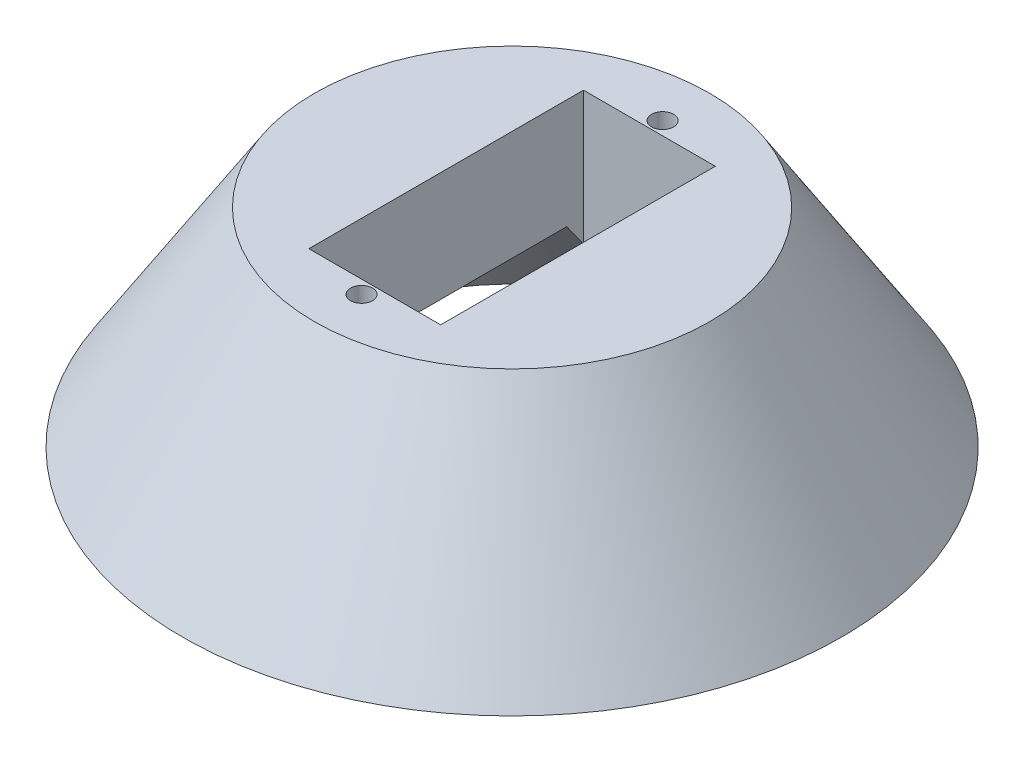
from build123d import *

# Parameters (mm, degrees)
SHELL2_T           = -10
SKETCH6_W          = 12
SKETCH6_H          = 25
CUT_EXTRUDE2_DEPTH = 47.434654221
SKETCH7_R          = 1
CUT_EXTRUDE3_DEPTH = 5


with BuildPart() as part:
    # Sketch5 → Revolve3 (revolve)
    with BuildSketch(Plane.XY, mode=Mode.PRIVATE) as revolve3_sk:
        Polygon((0, 0), (0, 18.872655155), (-18, 18.872655155), (-30, 0), align=None)
    revolve(revolve3_sk.sketch.rotate(Axis((0, 0, 0), (0, 1, 0)), 270), axis=Axis((0, 0, 0), (0, 1, 0)))

    # Shell2
    shell2_openings = [part.faces().sort_by_distance(p)[0] for p in [
        (0, 0, 0),
    ]]
    offset(amount=SHELL2_T, openings=shell2_openings, kind=Kind.INTERSECTION)

    # Sketch6 → Cut-Extrude2 (cut, through all)
    with BuildSketch(Plane(origin=(0, 18.872655155, 0), x_dir=(1, 0, 0), z_dir=(0, 1, 0))):
        Rectangle(SKETCH6_W, SKETCH6_H)
    extrude(amount=-CUT_EXTRUDE2_DEPTH, mode=Mode.SUBTRACT)

    # Sketch7 → Cut-Extrude3 (cut)
    with BuildSketch(Plane(origin=(0, 18.872655155, 0), x_dir=(1, 0, 0), z_dir=(0, 1, 0))):
        with Locations(Location((0, 13.7, 0), (0, 0, 270))):
            Circle(SKETCH7_R)
        with Locations(Location((0, -13.7, 0), (0, 0, 270))):
            Circle(SKETCH7_R)
    extrude(amount=-CUT_EXTRUDE3_DEPTH, mode=Mode.SUBTRACT)


solid = part.part
